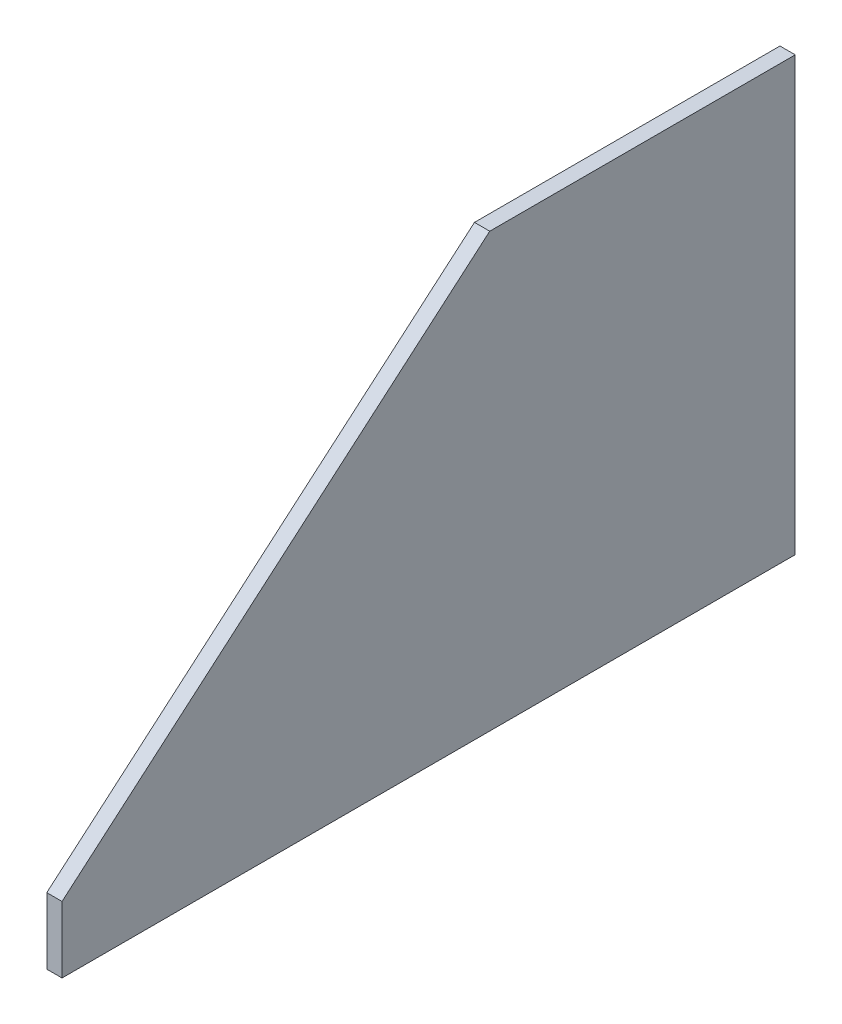
from build123d import *

# Parameters (mm, degrees)
ESQUISSE2_W        = 304.8
ESQUISSE2_H        = 27.559
BOSS_EXTRU_1_DEPTH = 6.35


with BuildPart() as part:
    # Esquisse2 → Boss.-Extru.1 (new body)
    with BuildSketch(Plane(origin=(0, 0, 0), x_dir=(0, 0, -1), z_dir=(1, 0, 0))):
        Polygon((0, 152.4), (0, 0), (-304.8, 0), (-127, 152.4), align=None)
        with Locations((-152.4, -13.7795)):
            Rectangle(ESQUISSE2_W, ESQUISSE2_H)
    extrude(amount=BOSS_EXTRU_1_DEPTH)


solid = part.part
